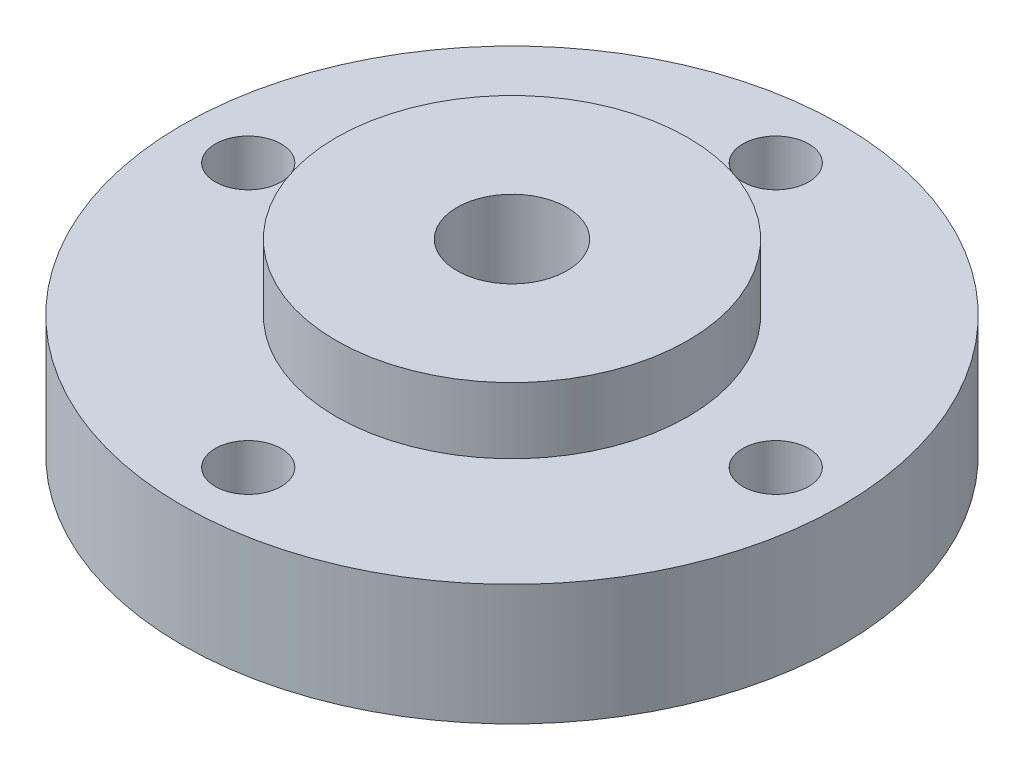
from build123d import *

# Parameters (mm, degrees)
SKETCH_1_R               = 15
SKETCH_1_R_2             = 2
SKETCH_1_R_3             = 1.5
EXTRUDE_1_DEPTH          = 3
EXTRUDE_2_DEPTH          = 4.25
EXTRUDE_2_DEPTH_BACK     = 7.25
SKETCH_2_R               = 8
EXTRUDE_3_DEPTH          = 1.25
EXTRUDE_3_DEPTH_BACK     = 4.25
SKETCH_5_R               = 15
CUT_EXTRUDE_1_DEPTH      = 5
CUT_EXTRUDE_1_DEPTH_BACK = 16.5
SKETCH_3_R               = 2.5
SKETCH_7_R               = 1.5
CUT_EXTRUDE_4_DEPTH      = 14
SKETCH_9_R               = 5
CUT_EXTRUDE_6_DEPTH      = 5


with BuildPart() as part:
    # 草图1 → 凸台-拉伸1 (new body)
    with BuildSketch(Plane(origin=(0, 0, 0), x_dir=(1, 0, 0), z_dir=(0, 1, 0))):
        with Locations(Location((0, 0, 0), (0, 0, 270))):
            Circle(SKETCH_1_R)
        with Locations(Location((0, 0, 0), (0, 0, 270))):
            Circle(SKETCH_1_R_2, mode=Mode.SUBTRACT)
        with Locations(Location((0, 6, 0), (0, 0, 270))):
            Circle(SKETCH_1_R_3, mode=Mode.SUBTRACT)
        with Locations(Location((6, 0, 0), (0, 0, 270))):
            Circle(SKETCH_1_R_3, mode=Mode.SUBTRACT)
        with Locations(Location((0, -6, 0), (0, 0, 270))):
            Circle(SKETCH_1_R_3, mode=Mode.SUBTRACT)
        with Locations(Location((-6, 0, 0), (0, 0, 270))):
            Circle(SKETCH_1_R_3, mode=Mode.SUBTRACT)
        with Locations(Location((0, 12, 0), (0, 0, 270))):
            Circle(SKETCH_1_R_3, mode=Mode.SUBTRACT)
        with Locations(Location((12, 0, 0), (0, 0, 270))):
            Circle(SKETCH_1_R_3, mode=Mode.SUBTRACT)
        with Locations(Location((0, -12, 0), (0, 0, 270))):
            Circle(SKETCH_1_R_3, mode=Mode.SUBTRACT)
        with Locations(Location((-12, 0, 0), (0, 0, 270))):
            Circle(SKETCH_1_R_3, mode=Mode.SUBTRACT)
    extrude(amount=EXTRUDE_1_DEPTH)

    # 草图2 → 凸台-拉伸2 (add, two sides: drawn at the far end of the back side and taken through both)
    with BuildSketch(Plane.XZ.offset(-EXTRUDE_2_DEPTH_BACK)):
        with Locations(Location((0, 0, 0), (0, 0, 270))):
            Circle(SKETCH_2_R)
    extrude(amount=EXTRUDE_2_DEPTH + EXTRUDE_2_DEPTH_BACK)

    # 草图5 → 凸台-拉伸3 (add, two sides: drawn at the far end of the back side and taken through both)
    with BuildSketch(Plane(origin=(0, 3, 0), x_dir=(1, 0, 0), z_dir=(0, 1, 0)).offset(-EXTRUDE_3_DEPTH_BACK)):
        with Locations(Location((0, 0, 0), (0, 0, 270))):
            Circle(SKETCH_5_R)
    extrude(amount=EXTRUDE_3_DEPTH + EXTRUDE_3_DEPTH_BACK)

    # 草图3 → 切除-拉伸1 (cut, two sides: drawn at the far end of the back side and taken through both)
    with BuildSketch(Plane(origin=(0, 3, 0), x_dir=(1, 0, 0), z_dir=(0, 1, 0)).offset(-CUT_EXTRUDE_1_DEPTH_BACK)):
        with Locations(Location((0, 0, 0), (0, 0, 90))):
            Circle(SKETCH_3_R)
    extrude(amount=CUT_EXTRUDE_1_DEPTH + CUT_EXTRUDE_1_DEPTH_BACK, mode=Mode.SUBTRACT)

    # 草图7 → 切除-拉伸4 (cut)
    with BuildSketch(Plane(origin=(0, 7.25, 0), x_dir=(1, 0, 0), z_dir=(0, 1, 0))):
        with Locations(Location((0, 12, 0), (0, 0, 270))):
            Circle(SKETCH_7_R)
        with Locations(Location((-12, 0, 0), (0, 0, 270))):
            Circle(SKETCH_7_R)
        with Locations(Location((12, 0, 0), (0, 0, 270))):
            Circle(SKETCH_7_R)
        with Locations(Location((0, -12, 0), (0, 0, 270))):
            Circle(SKETCH_7_R)
    extrude(amount=-CUT_EXTRUDE_4_DEPTH, mode=Mode.SUBTRACT)

    # 草图9 → 切除-拉伸6 (cut)
    with BuildSketch(Plane.XZ.offset(4.25)):
        with Locations(Location((0, 0, 0), (0, 0, 270))):
            Circle(SKETCH_9_R)
    extrude(amount=-CUT_EXTRUDE_6_DEPTH, mode=Mode.SUBTRACT)


solid = part.part
